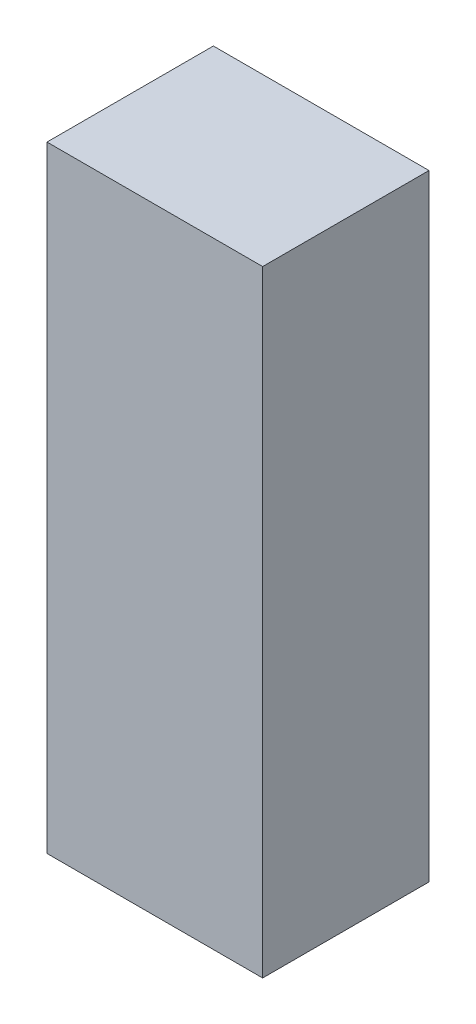
from build123d import *

# Parameters (mm, degrees)
POUCH_ENVELOPE_PROFILE_W = 35
POUCH_ENVELOPE_PROFILE_H = 100
POUCH_ENVELOPE_DEPTH     = 27


with BuildPart() as part:
    # Pouch envelope profile → Pouch envelope (new body)
    with BuildSketch(Plane.XY):
        Rectangle(POUCH_ENVELOPE_PROFILE_W, POUCH_ENVELOPE_PROFILE_H)
    extrude(amount=POUCH_ENVELOPE_DEPTH)


solid = part.part
